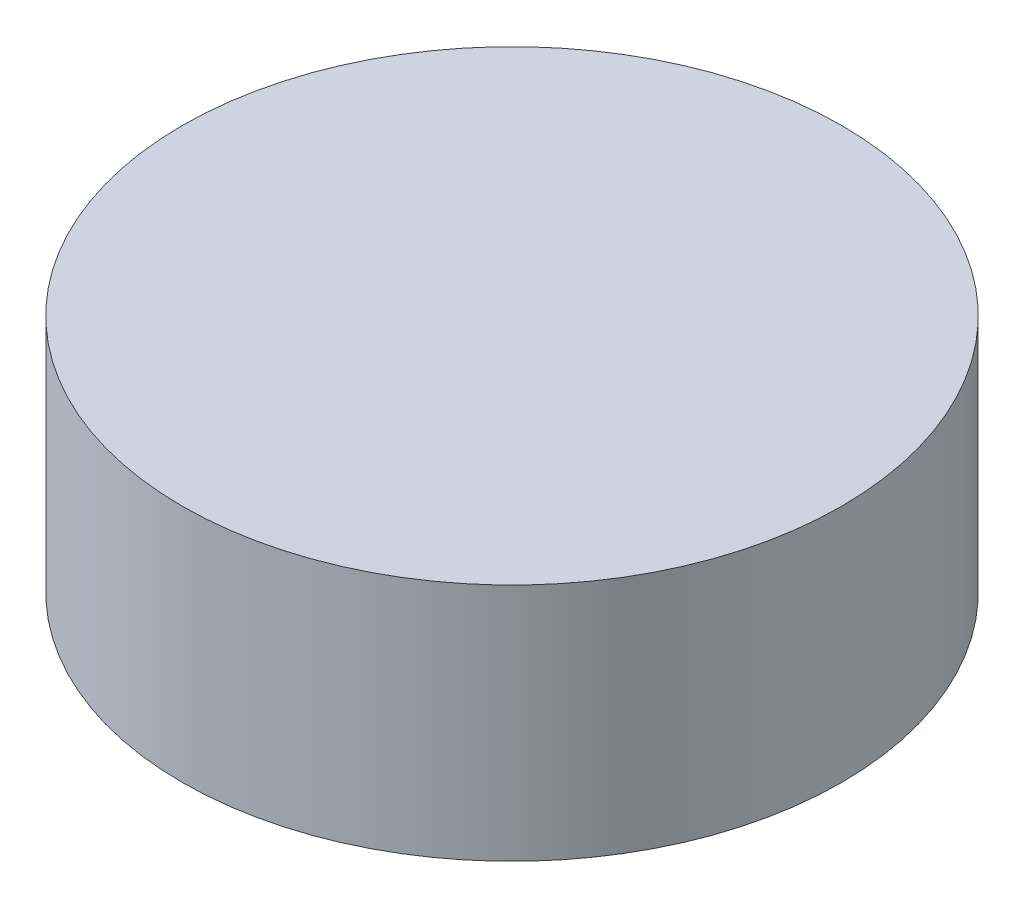
from build123d import *

# Parameters (mm, degrees)
SKETCH1_R           = 1.4
BOSS_EXTRUDE1_DEPTH = 1.016


with BuildPart() as part:
    # Sketch1 → Boss-Extrude1 (new body)
    with BuildSketch(Plane(origin=(0, 0, 0), x_dir=(1, 0, 0), z_dir=(0, 1, 0))):
        with Locations(Location((0, 0, 0), (0, 0, 270))):
            Circle(SKETCH1_R)
    extrude(amount=BOSS_EXTRUDE1_DEPTH)


solid = part.part
